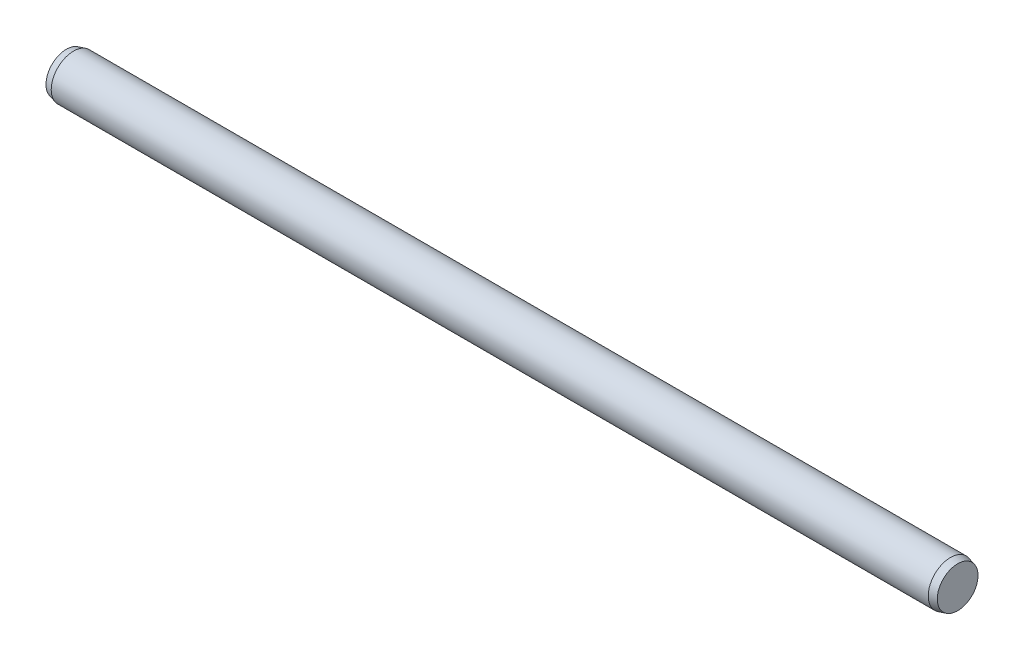
from build123d import *

# Parameters (mm, degrees)
EXTRUDE1_DEPTH      = 49.2
EXTRUDE1_DEPTH_BACK = 49.2
SKETCH2_R           = 2.5
SKETCH3_R           = 2.5
EXTRUDE2_DEPTH      = 0.8
EXTRUDE2_TAPER      = 15
SKETCH4_R           = 2.5
EXTRUDE3_DEPTH      = 0.8
EXTRUDE3_TAPER      = 15


with BuildPart() as part:
    # Sketch2 → Extrude1 (new, two sides: drawn at the far end of the back side and taken through both)
    with BuildSketch(Plane(origin=(0, 0, 0), x_dir=(0, 0, -1), z_dir=(1, 0, 0)).offset(-EXTRUDE1_DEPTH_BACK)):
        Circle(SKETCH2_R)
    extrude(amount=EXTRUDE1_DEPTH + EXTRUDE1_DEPTH_BACK)

    # Sketch3 → Extrude2 (add)
    with BuildSketch(Plane(origin=(49.2, 0, 0), x_dir=(0, 0, -1), z_dir=(1, 0, 0))):
        Circle(SKETCH3_R)
    extrude(amount=EXTRUDE2_DEPTH, taper=EXTRUDE2_TAPER)

    # Sketch4 → Extrude3 (add)
    with BuildSketch(Plane.ZY.offset(49.2)):
        with Locations(Location((0, 0, 0), (0, 0, 180))):
            Circle(SKETCH4_R)
    extrude(amount=EXTRUDE3_DEPTH, taper=EXTRUDE3_TAPER)


solid = part.part
